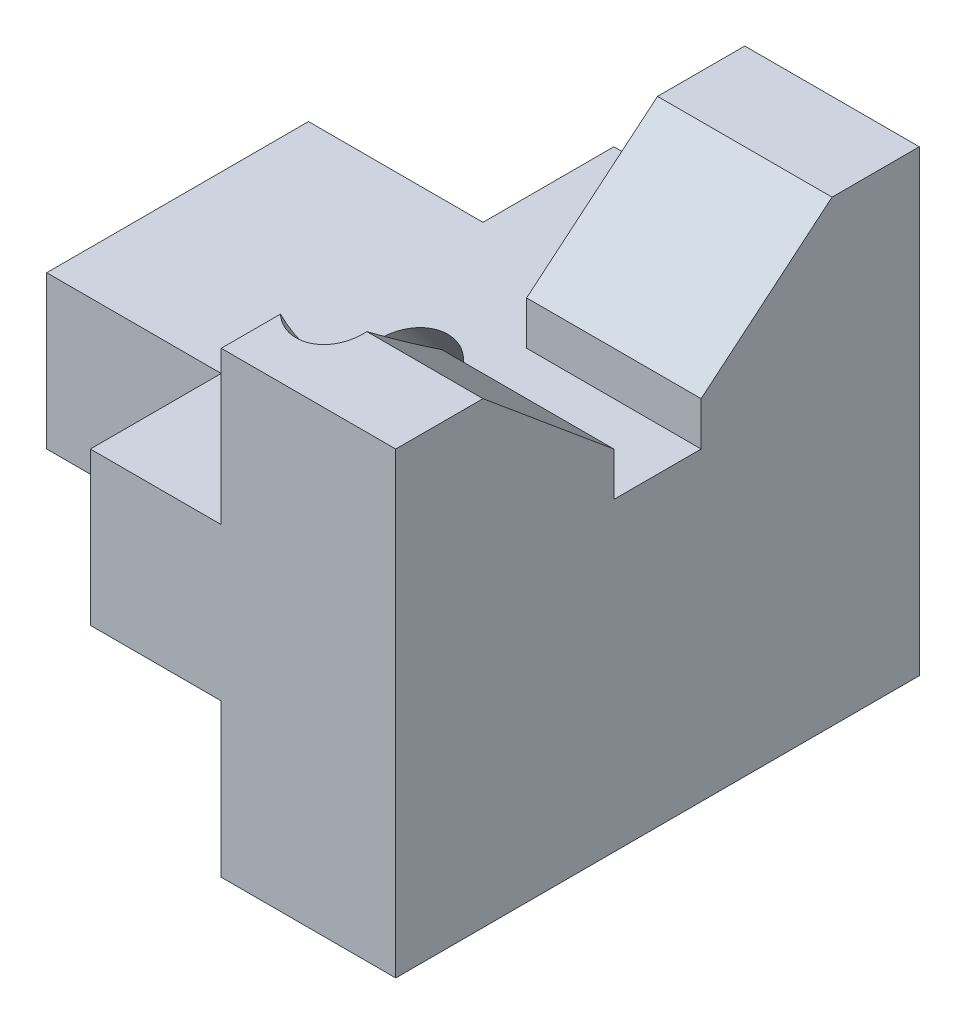
from build123d import *

# Parameters (mm, degrees)
BOSS_EXTRUDE1_DEPTH = 25.4
BOSS_EXTRUDE2_DEPTH = 22.225
SKETCH5_R           = 5.373343104
CUT_EXTRUDE1_DEPTH  = 60.6425
SKETCH6_W           = 0.284935897
SKETCH6_H           = 2.320192307
BOSS_EXTRUDE3_DEPTH = 2.54


with BuildPart() as part:
    # Sketch2 → Boss-Extrude1 (new body)
    with BuildSketch(Plane(origin=(0, 0, 0), x_dir=(0, 0, -1), z_dir=(1, 0, 0))):
        Polygon((38.1, 0), (38.1, 66.675), (25.4, 66.675), (6.35, 50.8), (6.35, 44.45), (-6.35, 44.45), (-6.35, 50.8), (-25.4, 66.675), (-38.1, 66.675), (-38.1, 0), align=None)
    extrude(amount=BOSS_EXTRUDE1_DEPTH)

    # Sketch3 → Boss-Extrude2 (add)
    with BuildSketch(Plane(origin=(0, 44.45, 0), x_dir=(1, 0, 0), z_dir=(0, 1, 0))):
        Polygon((0, 6.35), (0, 38.1), (-19.05, 38.1), (-19.05, 19.05), (-44.45, 19.05), (-44.45, -19.05), (-19.05, -19.05), (-19.05, -38.1), (0, -38.1), (0, -6.35), align=None)
    extrude(amount=-BOSS_EXTRUDE2_DEPTH)

    # Sketch5 → Cut-Extrude1 (cut, symmetric)
    with BuildSketch(Plane(origin=(8.980702108, 22.580051014, 19.757544637), x_dir=(0.9580053224689881, -0.21580168165029512, -0.1888264714440082), z_dir=(0.28675041782199756, 0.7209724790953078, 0.6308509192083942))):
        with Locations(Location((-16.337016409, 25.690827368, 0), (0, 0, 108.144733804))):
            Circle(SKETCH5_R)
    extrude(amount=CUT_EXTRUDE1_DEPTH, both=True, mode=Mode.SUBTRACT)

    # Sketch6 → Boss-Extrude3 (add)
    # profile 1 of 17: a face of its own
    with BuildSketch(Plane.XY.offset(38.1)):
        with BuildLine():
            Line((-13.170934397, 34.234214461), (-12.902534958, 34.395126921))
            add(Edge.make_bspline(
                [(-12.902534958, 34.395126921), (-12.877571986, 34.353339944), (-12.829743894, 34.273277707), (-12.749959447, 34.165093627), (-12.667288878, 34.073143671), (-12.581119982, 33.997962748), (-12.491978729, 33.938772687), (-12.399283195, 33.896860662), (-12.303345752, 33.870720456), (-12.238055214, 33.867545377), (-12.205459638, 33.865960255)],
                knots=[0, 0, 0, 0, 1.272034388, 2.437168799, 3.508375237, 4.49857839, 5.41946034, 6.295179144, 7.148887113, 8, 8, 8, 8], degree=3))
            add(Edge.make_bspline(
                [(-12.205459638, 33.865960255), (-12.177622271, 33.866735565), (-12.122434627, 33.868272619), (-12.041188878, 33.883041632), (-11.962283958, 33.905731206), (-11.887346122, 33.938225908), (-11.817409386, 33.977540106), (-11.756080455, 34.025025567), (-11.703061481, 34.078189768), (-11.659691784, 34.137501176), (-11.626417752, 34.201288875), (-11.600843519, 34.266762774), (-11.586651202, 34.334951404), (-11.58451329, 34.380862324), (-11.583434397, 34.404031168)],
                knots=[0, 0, 0, 0, 1.095163259, 2.171163733, 3.241058638, 4.321873601, 5.38011039, 6.391990106, 7.366004449, 8.327778327, 9.272591725, 10.192022065, 11.087607919, 12, 12, 12, 12], degree=3))
            add(Edge.make_bspline(
                [(-11.583434397, 34.404031168), (-11.584771808, 34.430466082), (-11.587490568, 34.484204398), (-11.610469839, 34.563488369), (-11.646618799, 34.641949486), (-11.679967768, 34.690482777), (-11.697281553, 34.715679806)],
                knots=[0, 0, 0, 0, 0.938893495, 1.908633276, 2.914225137, 4, 4, 4, 4], degree=3))
            add(Edge.make_bspline(
                [(-11.697281553, 34.715679806), (-11.711497039, 34.733865139), (-11.741340673, 34.77204297), (-11.792646416, 34.828871148), (-11.852849963, 34.887489286), (-11.919891045, 34.950135716), (-11.996211775, 35.013896788), (-12.079421735, 35.081813012), (-12.171645378, 35.151301585), (-12.236324207, 35.197903841), (-12.269697418, 35.221949838)],
                knots=[0, 0, 0, 0, 0.722233717, 1.516239348, 2.393582979, 3.351407094, 4.387010283, 5.505090956, 6.712668013, 8, 8, 8, 8], degree=3))
            add(Edge.make_bspline(
                [(-12.269697418, 35.221949838), (-12.303102043, 35.245742914), (-12.366969143, 35.291233463), (-12.456285143, 35.358746921), (-12.536154048, 35.420472431), (-12.60622087, 35.476991071), (-12.66645479, 35.528310505), (-12.717330456, 35.573937921), (-12.757551861, 35.615107294), (-12.779917995, 35.641814797), (-12.789959838, 35.653805808)],
                knots=[0, 0, 0, 0, 1.452282411, 2.77665338, 3.964542531, 5.026858415, 5.96415736, 6.766646006, 7.446254459, 8, 8, 8, 8], degree=3))
            add(Edge.make_bspline(
                [(-12.789959838, 35.653805808), (-12.803995647, 35.672493891), (-12.831598949, 35.709246515), (-12.868035254, 35.766691208), (-12.899004352, 35.82549517), (-12.92328161, 35.885816418), (-12.94372518, 35.946808104), (-12.957475588, 36.00926602), (-12.966085641, 36.072909909), (-12.966967372, 36.115739299), (-12.967408756, 36.137179205)],
                knots=[0, 0, 0, 0, 1.068054152, 2.10047183, 3.106115577, 4.101338837, 5.06977816, 6.043150881, 7.020423561, 8, 8, 8, 8], degree=3))
            add(Edge.make_bspline(
                [(-12.967408756, 36.137179205), (-12.966224745, 36.170770501), (-12.963882031, 36.237235101), (-12.944069561, 36.334327355), (-12.912797722, 36.427025033), (-12.86898736, 36.514410407), (-12.812511047, 36.594208118), (-12.747155056, 36.667336067), (-12.669311779, 36.728811853), (-12.583901899, 36.782525648), (-12.490415047, 36.824568023), (-12.392451871, 36.856282627), (-12.28985667, 36.874252454), (-12.220366683, 36.876831247), (-12.185107074, 36.878139742)],
                knots=[0, 0, 0, 0, 1.005424448, 1.989358655, 2.955360095, 3.929531133, 4.905563448, 5.876582895, 6.856512386, 7.866279853, 8.892233794, 9.918561126, 10.94386622, 12, 12, 12, 12], degree=3))
            add(Edge.make_bspline(
                [(-12.185107074, 36.878139742), (-12.147692783, 36.876849284), (-12.073287699, 36.874282976), (-11.963841625, 36.851969501), (-11.858467261, 36.815048178), (-11.773700871, 36.773148467), (-11.707359009, 36.731300682), (-11.656765173, 36.693182699), (-11.605495771, 36.649299565), (-11.55313725, 36.599534391), (-11.500576794, 36.543430553), (-11.447034091, 36.481372285), (-11.392383933, 36.413738838), (-11.357226831, 36.365456612), (-11.339203628, 36.340704846)],
                knots=[0, 0, 0, 0, 1.286793592, 2.559021753, 3.825965368, 5.121522368, 5.803751409, 6.523245864, 7.299691795, 8.125521123, 9.008227632, 9.944561021, 10.946284179, 12, 12, 12, 12], degree=3))
            Line((-11.339203628, 36.340704846), (-11.596790768, 36.145447434))
            add(Edge.make_bspline(
                [(-11.596790768, 36.145447434), (-11.612344578, 36.165485032), (-11.64229758, 36.20407276), (-11.687772185, 36.258112454), (-11.730633459, 36.307475974), (-11.772861322, 36.350352198), (-11.812225544, 36.389089133), (-11.850431718, 36.422254055), (-11.886930023, 36.450171917), (-11.932937506, 36.479965718), (-11.990738579, 36.509499117), (-12.06329598, 36.534490067), (-12.139120672, 36.549507873), (-12.190763981, 36.551493507), (-12.216907955, 36.552498716)],
                knots=[0, 0, 0, 0, 1.181633172, 2.275549214, 3.290209073, 4.226197932, 5.078386478, 5.862611352, 6.581680152, 7.217281963, 8.414376989, 9.595101626, 10.782541182, 12, 12, 12, 12], degree=3))
            add(Edge.make_bspline(
                [(-12.216907955, 36.552498716), (-12.249707086, 36.551399531), (-12.312957121, 36.549279857), (-12.402755406, 36.526129584), (-12.483576324, 36.489678897), (-12.553020437, 36.438593167), (-12.61083898, 36.378067695), (-12.652663218, 36.308418305), (-12.677836581, 36.231508554), (-12.680908421, 36.177858623), (-12.682472859, 36.150535575)],
                knots=[0, 0, 0, 0, 1.14458467, 2.207223713, 3.21896685, 4.227309161, 5.202851033, 6.127160689, 7.046193047, 8, 8, 8, 8], degree=3))
            add(Edge.make_bspline(
                [(-12.682472859, 36.150535575), (-12.682116237, 36.133525305), (-12.68140241, 36.099476951), (-12.6714467, 36.049174589), (-12.658656595, 35.998999303), (-12.638388636, 35.949176674), (-12.610407539, 35.898835363), (-12.573663558, 35.847108501), (-12.527387197, 35.793540165), (-12.491938764, 35.75869919), (-12.473223059, 35.740304205)],
                knots=[0, 0, 0, 0, 0.858281714, 1.717966888, 2.583508476, 3.4729293, 4.427298488, 5.488583878, 6.674047936, 8, 8, 8, 8], degree=3))
            add(Edge.make_bspline(
                [(-12.473223059, 35.740304205), (-12.4662731, 35.734102046), (-12.449761588, 35.719367136), (-12.419575569, 35.695244138), (-12.379713174, 35.665487337), (-12.33121532, 35.628668843), (-12.273187785, 35.585959231), (-12.205624187, 35.537904597), (-12.129277654, 35.482944931), (-12.075101344, 35.444520591), (-12.046455231, 35.424203444)],
                knots=[0, 0, 0, 0, 0.420754252, 0.999615792, 1.744751191, 2.668019286, 3.750313428, 4.999500688, 6.413464383, 8, 8, 8, 8], degree=3))
            add(Edge.make_bspline(
                [(-12.046455231, 35.424203444), (-12.011996581, 35.399128782), (-11.945272181, 35.350575175), (-11.850332805, 35.277626665), (-11.764250565, 35.206281903), (-11.68672323, 35.136996503), (-11.616984892, 35.070296018), (-11.555809245, 35.00537799), (-11.502572949, 34.942707507), (-11.445260373, 34.862359527), (-11.386697208, 34.763679544), (-11.33640384, 34.642777141), (-11.304691625, 34.521404765), (-11.300544608, 34.439828278), (-11.2984985, 34.399579045)],
                knots=[0, 0, 0, 0, 1.163667725, 2.253281268, 3.268753668, 4.215851969, 5.092017293, 5.902905408, 6.650798638, 7.335211899, 8.59617414, 9.77448103, 10.901945474, 12, 12, 12, 12], degree=3))
            add(Edge.make_bspline(
                [(-11.2984985, 34.399579045), (-11.299094618, 34.371114385), (-11.300275278, 34.31473783), (-11.313846964, 34.231956439), (-11.333731232, 34.151555578), (-11.363700723, 34.074529069), (-11.400279588, 33.999467749), (-11.446694684, 33.928340582), (-11.500495227, 33.859573349), (-11.56221157, 33.794999753), (-11.629744639, 33.735721418), (-11.701121991, 33.682990055), (-11.776460452, 33.639022362), (-11.855351325, 33.603144098), (-11.937812731, 33.575082979), (-12.023816935, 33.554751305), (-12.113505706, 33.54227291), (-12.174466143, 33.540977726), (-12.205459638, 33.540319229)],
                knots=[0, 0, 0, 0, 0.983748083, 1.948392443, 2.894712957, 3.844097841, 4.80183111, 5.778335162, 6.776009319, 7.81870978, 8.863265674, 9.881300176, 10.883814829, 11.87499822, 12.874611388, 13.892143829, 14.928324115, 16, 16, 16, 16], degree=3))
            add(Edge.make_bspline(
                [(-12.205459638, 33.540319229), (-12.22944027, 33.540782944), (-12.277099524, 33.541704533), (-12.347593126, 33.549851838), (-12.41666261, 33.561378996), (-12.48344128, 33.579679759), (-12.548789504, 33.601883874), (-12.612423066, 33.629223647), (-12.674372808, 33.661987109), (-12.734985901, 33.699447595), (-12.794108188, 33.743042835), (-12.851185134, 33.793818793), (-12.908089466, 33.850375072), (-12.963141605, 33.914247512), (-13.0174551, 33.984404201), (-13.069959086, 34.061501532), (-13.121740358, 34.14511956), (-13.154230104, 34.203961459), (-13.170934397, 34.234214461)],
                knots=[0, 0, 0, 0, 0.915332311, 1.819136955, 2.706846663, 3.586547465, 4.459518054, 5.340707479, 6.227863349, 7.133153174, 8.059268498, 9.028702269, 10.047606654, 11.120612155, 12.245963614, 13.433783089, 14.680604001, 16, 16, 16, 16], degree=3))
        make_face()
    # profile 2 of 17: a face of its own
    with BuildSketch(Plane.XY.offset(38.1)):
        Polygon((-10.443690808, 36.878139742), (-10.15875491, 36.878139742), (-10.15875491, 35.941921793), (-9.751703628, 35.941921793), (-9.751703628, 35.656985896), (-10.15875491, 35.656985896), (-10.15875491, 33.621729486), (-10.443690808, 33.621729486), (-10.443690808, 35.656985896), (-10.85074209, 35.656985896), (-10.85074209, 35.941921793), (-10.443690808, 35.941921793), align=None)
    # profile 3 of 17: a face of its own
    with BuildSketch(Plane.XY.offset(38.1)):
        with BuildLine():
            Line((-6.902344654, 35.941921793), (-6.902344654, 33.621729486))
            Line((-6.902344654, 33.621729486), (-7.187280551, 33.621729486))
            Line((-7.187280551, 33.621729486), (-7.187280551, 34.023056609))
            add(Edge.make_bspline(
                [(-7.187280551, 34.023056609), (-7.219410454, 33.986734977), (-7.282112364, 33.915852856), (-7.386833949, 33.823249743), (-7.497839368, 33.746706551), (-7.614589852, 33.684884842), (-7.736979973, 33.638446334), (-7.864738423, 33.605438889), (-7.997917319, 33.584217339), (-8.088860526, 33.582098233), (-8.134946817, 33.581024357)],
                knots=[0, 0, 0, 0, 1.074387032, 2.096679803, 3.090159297, 4.057316773, 5.018401886, 5.985159533, 6.978961417, 8, 8, 8, 8], degree=3))
            add(Edge.make_bspline(
                [(-8.134946817, 33.581024357), (-8.175920604, 33.582136852), (-8.256722726, 33.584330741), (-8.375584817, 33.601350831), (-8.4899685, 33.628683609), (-8.599981863, 33.666693702), (-8.704913023, 33.717113447), (-8.805660397, 33.777475865), (-8.901702053, 33.849358618), (-8.991574092, 33.931534901), (-9.074334549, 34.020793211), (-9.146961561, 34.115993814), (-9.207516141, 34.216725047), (-9.258152928, 34.321711551), (-9.297156755, 34.431761513), (-9.324347123, 34.546494373), (-9.341347385, 34.665774472), (-9.343540368, 34.746999611), (-9.344652346, 34.788185816)],
                knots=[0, 0, 0, 0, 1.033919861, 2.038935746, 3.024066025, 3.998881131, 4.97069526, 5.957263378, 6.95902576, 7.993208707, 9.027059324, 10.027763471, 11.009749337, 11.988697705, 12.965288445, 13.950418724, 14.960734635, 16, 16, 16, 16], degree=3))
            add(Edge.make_bspline(
                [(-9.344652346, 34.788185816), (-9.343515722, 34.828520747), (-9.341268678, 34.90826073), (-9.324528971, 35.025534977), (-9.296379413, 35.138490828), (-9.256875294, 35.246764626), (-9.206218664, 35.350487386), (-9.144598185, 35.449732466), (-9.072009407, 35.544773277), (-8.988323295, 35.633375032), (-8.897668182, 35.715218018), (-8.800686691, 35.786346224), (-8.699791286, 35.847775079), (-8.593416983, 35.896446447), (-8.483138252, 35.935824706), (-8.367973341, 35.963068899), (-8.248401409, 35.979122897), (-8.167220748, 35.98144769), (-8.12604257, 35.982626921)],
                knots=[0, 0, 0, 0, 1.020392517, 2.01726096, 2.990465484, 3.961182959, 4.928053699, 5.906110375, 6.912531644, 7.948652711, 8.985773172, 9.998621852, 10.987621588, 11.969261332, 12.953316658, 13.946091881, 14.958173133, 16, 16, 16, 16], degree=3))
            add(Edge.make_bspline(
                [(-8.12604257, 35.982626921), (-8.078689841, 35.981322675), (-7.985833374, 35.97876511), (-7.85000868, 35.957481065), (-7.721516903, 35.921523313), (-7.59936617, 35.872612439), (-7.483995119, 35.807616807), (-7.376495983, 35.725629271), (-7.275743723, 35.627166908), (-7.217341601, 35.551538005), (-7.187280551, 35.512609894)],
                knots=[0, 0, 0, 0, 1.038897134, 2.037228247, 3.008116434, 3.962042015, 4.918381754, 5.904844433, 6.921570401, 8, 8, 8, 8], degree=3))
            Line((-7.187280551, 35.512609894), (-7.187280551, 35.941921793))
            Line((-7.187280551, 35.941921793), (-6.902344654, 35.941921793))
        make_face()
        with BuildLine():
            add(Edge.make_bspline(
                [(-8.122226465, 35.697691024), (-8.163877328, 35.696209081), (-8.246089508, 35.693283962), (-8.366779424, 35.670448005), (-8.482270879, 35.632452695), (-8.591986246, 35.580489827), (-8.694192414, 35.515149473), (-8.785535958, 35.436117933), (-8.86676398, 35.345551499), (-8.935079334, 35.24385887), (-8.990769285, 35.134840173), (-9.02992795, 35.020880861), (-9.055753624, 34.904036346), (-9.058392068, 34.82478591), (-9.059716449, 34.785005728)],
                knots=[0, 0, 0, 0, 1.031046209, 2.035121221, 3.029706178, 4.034933723, 5.034054252, 6.02443088, 7.017295772, 8.038157696, 9.050218397, 10.03989886, 11.016116709, 12, 12, 12, 12], degree=3))
            add(Edge.make_bspline(
                [(-9.059716449, 34.785005728), (-9.058024724, 34.745463273), (-9.054647906, 34.666533357), (-9.030381204, 34.549529549), (-8.989668748, 34.435543382), (-8.934113448, 34.325542338), (-8.864547724, 34.223412475), (-8.783913018, 34.13111965), (-8.691429548, 34.051754095), (-8.588988167, 33.985317153), (-8.479579508, 33.931648295), (-8.364523013, 33.894305179), (-8.245981541, 33.870195335), (-8.165379781, 33.867379131), (-8.124770535, 33.865960255)],
                knots=[0, 0, 0, 0, 0.979072187, 1.954306742, 2.945804271, 3.96968567, 4.997920485, 5.998718438, 6.996577872, 8.005894225, 9.015743152, 10.005417472, 10.995077863, 12, 12, 12, 12], degree=3))
            add(Edge.make_bspline(
                [(-8.124770535, 33.865960255), (-8.083544065, 33.867466079), (-8.001548704, 33.870461015), (-7.880500734, 33.893394734), (-7.763030303, 33.931285001), (-7.650737603, 33.98380778), (-7.546129398, 34.048901953), (-7.452242038, 34.125108386), (-7.372852552, 34.213739131), (-7.305549256, 34.311144914), (-7.252775843, 34.41792651), (-7.214334703, 34.531622526), (-7.191607232, 34.652236919), (-7.18874272, 34.734663482), (-7.187280551, 34.776737498)],
                knots=[0, 0, 0, 0, 1.01762866, 2.023962475, 3.030623092, 4.058876274, 5.077231937, 6.066672613, 7.034107872, 8.005628644, 8.981990164, 9.965428785, 10.961468474, 12, 12, 12, 12], degree=3))
            add(Edge.make_bspline(
                [(-7.187280551, 34.776737498), (-7.188151097, 34.808793959), (-7.189864606, 34.871891218), (-7.202955194, 34.964535466), (-7.223778591, 35.053193917), (-7.253121188, 35.137959785), (-7.291666853, 35.218364406), (-7.338155898, 35.294985103), (-7.393405842, 35.367423373), (-7.456527288, 35.434681731), (-7.525620007, 35.496028593), (-7.598730769, 35.550787583), (-7.676725775, 35.595771684), (-7.758293373, 35.63300198), (-7.843575083, 35.662628494), (-7.93326486, 35.682393045), (-8.02640937, 35.695964194), (-8.089951148, 35.697109353), (-8.122226465, 35.697691024)],
                knots=[0, 0, 0, 0, 1.050140795, 2.067009409, 3.05949893, 4.030605086, 5.00011959, 5.97591094, 6.962425594, 7.979863591, 8.993523472, 9.986985069, 10.967611495, 11.937549037, 12.921786183, 13.919465291, 14.943216303, 16, 16, 16, 16], degree=3))
        make_face(mode=Mode.SUBTRACT)
    # profile 4 of 17: a face of its own
    with BuildSketch(Plane.XY.offset(38.1)):
        with BuildLine():
            Line((-3.971575423, 35.438831849), (-4.210082034, 35.290639742))
            add(Edge.make_bspline(
                [(-4.210082034, 35.290639742), (-4.23623484, 35.323141213), (-4.287712199, 35.387114842), (-4.377101364, 35.469673853), (-4.472361718, 35.540582527), (-4.57512109, 35.598370929), (-4.685235351, 35.643021816), (-4.802270252, 35.674617789), (-4.926209103, 35.694306637), (-5.011176819, 35.696544411), (-5.054713444, 35.697691024)],
                knots=[0, 0, 0, 0, 1.026593902, 2.0206758, 2.988051866, 3.946915611, 4.916868779, 5.907761954, 6.927957743, 8, 8, 8, 8], degree=3))
            add(Edge.make_bspline(
                [(-5.054713444, 35.697691024), (-5.089510498, 35.696732317), (-5.158042349, 35.69484417), (-5.258650074, 35.683041794), (-5.35448278, 35.661595115), (-5.446141137, 35.633336747), (-5.532973231, 35.59546327), (-5.615206564, 35.549371562), (-5.693570545, 35.49580474), (-5.765794303, 35.433746603), (-5.831860616, 35.366256383), (-5.889100345, 35.293908388), (-5.938935992, 35.218869629), (-5.978039252, 35.139266263), (-6.010038871, 35.056919415), (-6.031090682, 34.970274703), (-6.04511937, 34.880442153), (-6.046724404, 34.819193373), (-6.047536961, 34.788185816)],
                knots=[0, 0, 0, 0, 1.112346261, 2.190735716, 3.231507886, 4.247384806, 5.251966152, 6.253067467, 7.256802811, 8.280671706, 9.291813951, 10.270744147, 11.225547591, 12.165006084, 13.100104208, 14.043489273, 15.009504848, 16, 16, 16, 16], degree=3))
            add(Edge.make_bspline(
                [(-6.047536961, 34.788185816), (-6.045922926, 34.747573746), (-6.042716601, 34.666896818), (-6.01758742, 34.547808826), (-5.976453565, 34.432670907), (-5.920158229, 34.322300525), (-5.848968257, 34.220161541), (-5.765354575, 34.128555122), (-5.669270835, 34.049256296), (-5.561563649, 33.983513363), (-5.444761982, 33.930661979), (-5.32012953, 33.893008899), (-5.188684729, 33.870282818), (-5.098690037, 33.867419927), (-5.052805391, 33.865960255)],
                knots=[0, 0, 0, 0, 0.966302908, 1.919585723, 2.883856336, 3.870342332, 4.860282998, 5.839159637, 6.814385684, 7.815993281, 8.834850808, 9.858348828, 10.908058873, 12, 12, 12, 12], degree=3))
            add(Edge.make_bspline(
                [(-5.052805391, 33.865960255), (-5.010754617, 33.867139084), (-4.928113686, 33.869455797), (-4.807311935, 33.888985643), (-4.692304444, 33.920956653), (-4.583095302, 33.965540593), (-4.479884066, 34.023169125), (-4.3833376, 34.094252087), (-4.291534799, 34.176744575), (-4.237562541, 34.24053302), (-4.210082034, 34.273011537)],
                knots=[0, 0, 0, 0, 1.039848629, 2.043578496, 3.018386758, 3.987534228, 4.954977003, 5.934852016, 6.948509513, 8, 8, 8, 8], degree=3))
            Line((-4.210082034, 34.273011537), (-3.971575423, 34.1165512))
            add(Edge.make_bspline(
                [(-3.971575423, 34.1165512), (-3.985715696, 34.095786041), (-4.013949308, 34.054324644), (-4.061145797, 33.995864624), (-4.112054501, 33.941144241), (-4.16647681, 33.890236844), (-4.223702112, 33.841924212), (-4.285685287, 33.798515998), (-4.350427721, 33.757572266), (-4.418689457, 33.720730589), (-4.489764733, 33.687614141), (-4.563553537, 33.659137864), (-4.639735225, 33.634672125), (-4.718399366, 33.615225389), (-4.799701045, 33.599703414), (-4.883429999, 33.589403985), (-4.969557391, 33.581715694), (-5.0277707, 33.581256801), (-5.057257514, 33.581024357)],
                knots=[0, 0, 0, 0, 0.954134338, 1.905101784, 2.851144739, 3.791306361, 4.734911809, 5.6936923, 6.663572882, 7.643865596, 8.638447847, 9.640600242, 10.646758161, 11.676244097, 12.717260333, 13.78922464, 14.880174919, 16, 16, 16, 16], degree=3))
            add(Edge.make_bspline(
                [(-5.057257514, 33.581024357), (-5.102261673, 33.581832875), (-5.190470151, 33.583417577), (-5.319576997, 33.600842408), (-5.442960824, 33.627111103), (-5.560579477, 33.664815347), (-5.672451268, 33.713351822), (-5.778471883, 33.77263988), (-5.878290271, 33.843171861), (-5.970919338, 33.923692373), (-6.055992507, 34.010996383), (-6.129041265, 34.105203094), (-6.192400904, 34.202848902), (-6.243280318, 34.306090401), (-6.283781458, 34.413555417), (-6.311453699, 34.526104849), (-6.32935139, 34.642810823), (-6.331422741, 34.72239708), (-6.332472859, 34.762745111)],
                knots=[0, 0, 0, 0, 1.1129367, 2.181364009, 3.217532258, 4.231199276, 5.232079859, 6.230262199, 7.231623845, 8.250719726, 9.263571943, 10.242672461, 11.195837495, 12.138959767, 13.085126421, 14.0317438, 15.002148558, 16, 16, 16, 16], degree=3))
            add(Edge.make_bspline(
                [(-6.332472859, 34.762745111), (-6.332072794, 34.790121262), (-6.331277, 34.844576945), (-6.322149394, 34.925398899), (-6.310357922, 35.005144508), (-6.290377432, 35.082802939), (-6.267299145, 35.159552023), (-6.237839198, 35.234466694), (-6.203281233, 35.307895076), (-6.164045537, 35.379648016), (-6.11987789, 35.448545098), (-6.070999914, 35.513635923), (-6.019252552, 35.575702424), (-5.962214936, 35.632601836), (-5.902307536, 35.686609666), (-5.837835464, 35.736283108), (-5.769168513, 35.78176815), (-5.697337927, 35.823905856), (-5.62238551, 35.861424772), (-5.544764317, 35.89374921), (-5.464942069, 35.921374046), (-5.382791081, 35.94324428), (-5.298856624, 35.961584371), (-5.212477267, 35.973121275), (-5.123983465, 35.981273108), (-5.064061216, 35.982171898), (-5.033724862, 35.982626921)],
                knots=[0, 0, 0, 0, 0.990994727, 1.971252077, 2.943264845, 3.907940874, 4.872158414, 5.844625996, 6.82015047, 7.809835459, 8.804511986, 9.781214284, 10.756496977, 11.728388426, 12.696359165, 13.676225489, 14.672885716, 15.677705647, 16.690706858, 17.706033469, 18.721040654, 19.747369689, 20.783475414, 21.830280724, 22.901553713, 24, 24, 24, 24], degree=3))
            add(Edge.make_bspline(
                [(-5.033724862, 35.982626921), (-4.995733621, 35.981790635), (-4.919941038, 35.980122241), (-4.807509111, 35.966080892), (-4.696733185, 35.944911429), (-4.589556884, 35.913548933), (-4.487279689, 35.875572617), (-4.391543959, 35.832925369), (-4.304603293, 35.783400264), (-4.224840409, 35.729225589), (-4.152106132, 35.668119625), (-4.085653843, 35.599351885), (-4.024120847, 35.523280264), (-3.989235115, 35.467213637), (-3.971575423, 35.438831849)],
                knots=[0, 0, 0, 0, 1.095225653, 2.184976855, 3.262915854, 4.344593502, 5.400796181, 6.407717688, 7.363229445, 8.282371371, 9.184954523, 10.097238608, 11.036792983, 12, 12, 12, 12], degree=3))
        make_face()
    # profile 5 of 17: a face of its own
    with BuildSketch(Plane.XY.offset(38.1)):
        with BuildLine():
            add(Edge.make_bspline(
                [(-3.301212843, 36.91884487), (-3.283531435, 36.918024675), (-3.248907842, 36.916418575), (-3.198839664, 36.902664949), (-3.153249374, 36.879351663), (-3.112811002, 36.848073667), (-3.078111077, 36.811289529), (-3.053817147, 36.768417079), (-3.038203044, 36.722099599), (-3.036317498, 36.689791626), (-3.035357474, 36.673342066)],
                knots=[0, 0, 0, 0, 1.055194115, 2.066272739, 3.074728998, 4.095836921, 5.109056067, 6.073838105, 7.019297344, 8, 8, 8, 8], degree=3))
            add(Edge.make_bspline(
                [(-3.035357474, 36.673342066), (-3.036339148, 36.657319516), (-3.0382798, 36.625644832), (-3.053805086, 36.580130325), (-3.078318116, 36.537853582), (-3.112788752, 36.501140866), (-3.15325527, 36.469880161), (-3.198838098, 36.446562291), (-3.248908254, 36.43280988), (-3.283531574, 36.431203613), (-3.301212843, 36.430383332)],
                knots=[0, 0, 0, 0, 0.96129708, 1.900370562, 2.859976407, 3.87933698, 4.906634145, 5.921202961, 6.938410037, 8, 8, 8, 8], degree=3))
            add(Edge.make_bspline(
                [(-3.301212843, 36.430383332), (-3.318691921, 36.431172292), (-3.352712663, 36.432707901), (-3.402031156, 36.446832131), (-3.447232714, 36.46988814), (-3.487749953, 36.50093618), (-3.521523057, 36.538079051), (-3.546105109, 36.580104524), (-3.561594539, 36.6256514), (-3.563540023, 36.657321723), (-3.564524141, 36.673342066)],
                knots=[0, 0, 0, 0, 1.054934014, 2.053291228, 3.073705704, 4.106921865, 5.123545215, 6.088680038, 7.033164197, 8, 8, 8, 8], degree=3))
            add(Edge.make_bspline(
                [(-3.564524141, 36.673342066), (-3.563561584, 36.689789336), (-3.561671061, 36.722092814), (-3.546093498, 36.768443308), (-3.521727816, 36.811062242), (-3.48772759, 36.84827823), (-3.447238665, 36.879343732), (-3.402029618, 36.902395122), (-3.352713069, 36.916520552), (-3.318692059, 36.918055995), (-3.301212843, 36.91884487)],
                knots=[0, 0, 0, 0, 0.98631895, 1.937192651, 2.907499808, 3.917963147, 4.944918757, 5.95915025, 6.951458133, 8, 8, 8, 8], degree=3))
        make_face()
    # profile 6 of 17: a face of its own
    with BuildSketch(Plane.XY.offset(38.1)):
        with Locations((-3.299940808, 34.781825639)):
            Rectangle(SKETCH6_W, SKETCH6_H)
    # profile 7 of 17: a face of its own
    with BuildSketch(Plane.XY.offset(38.1)):
        with BuildLine():
            Line((-0.561248901, 34.354421793), (-0.308113885, 34.221494109))
            add(Edge.make_bspline(
                [(-0.308113885, 34.221494109), (-0.328285653, 34.185713373), (-0.367531927, 34.116098229), (-0.435024034, 34.02045647), (-0.505773985, 33.934416042), (-0.582975442, 33.86027557), (-0.664318651, 33.795640385), (-0.750254702, 33.739091073), (-0.841230986, 33.690904987), (-0.937251808, 33.650308051), (-1.039123544, 33.619093724), (-1.147093062, 33.597046323), (-1.261367204, 33.583418073), (-1.339695525, 33.581834981), (-1.379803588, 33.581024357)],
                knots=[0, 0, 0, 0, 1.120438281, 2.179929193, 3.190490725, 4.156257408, 5.095198341, 6.022838206, 6.959905092, 7.901321166, 8.864066838, 9.862729781, 10.905609505, 12, 12, 12, 12], degree=3))
            add(Edge.make_bspline(
                [(-1.379803588, 33.581024357), (-1.424382382, 33.582065009), (-1.511342694, 33.58409502), (-1.637925179, 33.601596041), (-1.75710508, 33.630145966), (-1.868875697, 33.670028993), (-1.972963312, 33.72212378), (-2.069574801, 33.785587024), (-2.159218228, 33.860092712), (-2.239068761, 33.9462862), (-2.310954283, 34.038526262), (-2.374386991, 34.134643386), (-2.427416232, 34.234395739), (-2.470553243, 34.337148286), (-2.505391942, 34.442253389), (-2.529673166, 34.550667364), (-2.543670152, 34.662096786), (-2.545815042, 34.737477941), (-2.546895936, 34.775465463)],
                knots=[0, 0, 0, 0, 1.145258523, 2.234067595, 3.276747158, 4.290159414, 5.277019952, 6.260822364, 7.254936242, 8.264827045, 9.274100331, 10.257902744, 11.220704747, 12.172965371, 13.118907548, 14.062713208, 15.023725156, 16, 16, 16, 16], degree=3))
            add(Edge.make_bspline(
                [(-2.546895936, 34.775465463), (-2.545935143, 34.811111488), (-2.54403098, 34.881757201), (-2.532028765, 34.986319517), (-2.510757814, 35.087945327), (-2.481569291, 35.186719077), (-2.443876375, 35.282475384), (-2.39776429, 35.375272527), (-2.343161205, 35.465011761), (-2.301003851, 35.521620318), (-2.279768532, 35.550134934)],
                knots=[0, 0, 0, 0, 1.024358464, 2.0301432, 3.019427413, 4.004406732, 4.986367066, 5.972626655, 6.978780325, 8, 8, 8, 8], degree=3))
            add(Edge.make_bspline(
                [(-2.279768532, 35.550134934), (-2.251005134, 35.584487409), (-2.19438949, 35.65210416), (-2.098634796, 35.740948213), (-1.994948189, 35.815373637), (-1.884629071, 35.877065825), (-1.76639527, 35.923941205), (-1.641836127, 35.958873083), (-1.509533345, 35.978447422), (-1.419086466, 35.981212242), (-1.372807394, 35.982626921)],
                knots=[0, 0, 0, 0, 1.030682036, 2.02871468, 2.997146059, 3.962720338, 4.930598197, 5.918074684, 6.934738563, 8, 8, 8, 8], degree=3))
            add(Edge.make_bspline(
                [(-1.372807394, 35.982626921), (-1.325229924, 35.981398606), (-1.231893772, 35.97898893), (-1.095793205, 35.956649328), (-0.967014555, 35.921223082), (-0.845609355, 35.871190715), (-0.731565295, 35.806638835), (-0.625623665, 35.726681594), (-0.52597265, 35.633773757), (-0.467998439, 35.562324274), (-0.438497498, 35.525966264)],
                knots=[0, 0, 0, 0, 1.056321875, 2.072262726, 3.055038591, 4.01806755, 4.982017516, 5.957941055, 6.960871419, 8, 8, 8, 8], degree=3))
            add(Edge.make_bspline(
                [(-0.438497498, 35.525966264), (-0.418425204, 35.498567301), (-0.378414223, 35.443951751), (-0.328297211, 35.354896487), (-0.284793003, 35.261723305), (-0.250019531, 35.162926107), (-0.221862269, 35.059675488), (-0.201490727, 34.951233322), (-0.189544001, 34.837631902), (-0.187195683, 34.760228527), (-0.1859985, 34.720767947)],
                knots=[0, 0, 0, 0, 0.94817472, 1.890038105, 2.849395472, 3.817997239, 4.812318967, 5.836947057, 6.897266129, 8, 8, 8, 8], degree=3))
            Line((-0.1859985, 34.720767947), (-2.261960038, 34.720767947))
            add(Edge.make_bspline(
                [(-2.261960038, 34.720767947), (-2.260563395, 34.690196812), (-2.257816953, 34.630079907), (-2.245012502, 34.542113554), (-2.224829686, 34.458317736), (-2.196464179, 34.379320977), (-2.162113541, 34.304091504), (-2.120035069, 34.23318737), (-2.069834188, 34.166931534), (-2.013840161, 34.104731345), (-1.95151301, 34.049340511), (-1.885942232, 33.999763543), (-1.816188784, 33.958211323), (-1.742802665, 33.924483851), (-1.665902546, 33.898080265), (-1.585464198, 33.880057313), (-1.501645906, 33.867985866), (-1.444508848, 33.866643598), (-1.415420575, 33.865960255)],
                knots=[0, 0, 0, 0, 1.094153842, 2.151609401, 3.174256925, 4.172055639, 5.149267565, 6.128595816, 7.11444997, 8.118368179, 9.117203808, 10.09244225, 11.054858984, 12.015122123, 12.976791628, 13.957293641, 14.960065497, 16, 16, 16, 16], degree=3))
            add(Edge.make_bspline(
                [(-1.415420575, 33.865960255), (-1.386980606, 33.866511849), (-1.33055025, 33.867606318), (-1.246511758, 33.878248837), (-1.163835187, 33.895457587), (-1.082862724, 33.918943507), (-1.005237742, 33.947588222), (-0.933350707, 33.982152958), (-0.86723794, 34.020388799), (-0.805446121, 34.064121862), (-0.745510291, 34.117650717), (-0.686053892, 34.184448835), (-0.622302928, 34.263449664), (-0.582398084, 34.322908947), (-0.561248901, 34.354421793)],
                knots=[0, 0, 0, 0, 0.99110716, 1.966546729, 2.947904876, 3.932708344, 4.903319531, 5.828989031, 6.710028674, 7.56322171, 8.463672341, 9.504779593, 10.677557249, 12, 12, 12, 12], degree=3))
        make_face()
        with BuildLine():
            add(Edge.make_bspline(
                [(-0.470934397, 35.005703844), (-0.481363478, 35.043498023), (-0.501436102, 35.11623965), (-0.543379089, 35.216969601), (-0.590615416, 35.306493625), (-0.646515129, 35.384126578), (-0.709850687, 35.453072622), (-0.783007389, 35.513323767), (-0.865045664, 35.567223883), (-0.955541456, 35.612719365), (-1.051373646, 35.651445165), (-1.151709263, 35.677412235), (-1.254087399, 35.695200891), (-1.323333502, 35.696857432), (-1.358178989, 35.697691024)],
                knots=[0, 0, 0, 0, 1.154881502, 2.222775134, 3.210006277, 4.132804581, 5.035138423, 5.962687519, 6.919655026, 7.923214229, 8.944639381, 9.960483929, 10.97369054, 12, 12, 12, 12], degree=3))
            add(Edge.make_bspline(
                [(-1.358178989, 35.697691024), (-1.386617408, 35.697136151), (-1.442834184, 35.696039282), (-1.525657296, 35.685634236), (-1.605195308, 35.668434949), (-1.682035105, 35.644881024), (-1.75516975, 35.613486077), (-1.826103575, 35.576671293), (-1.893032935, 35.531729999), (-1.934889681, 35.497477324), (-1.956035559, 35.480172995)],
                knots=[0, 0, 0, 0, 1.04873581, 2.073130211, 3.073294108, 4.04793562, 5.032784715, 6.005352987, 6.992311501, 8, 8, 8, 8], degree=3))
            add(Edge.make_bspline(
                [(-1.956035559, 35.480172995), (-1.971178751, 35.466480295), (-2.00182488, 35.438769606), (-2.042773781, 35.391027397), (-2.081980924, 35.339545623), (-2.117662167, 35.282354688), (-2.150389691, 35.220105839), (-2.181014814, 35.153324127), (-2.20857963, 35.081502787), (-2.224088244, 35.031453503), (-2.23206721, 35.005703844)],
                knots=[0, 0, 0, 0, 0.879870761, 1.780643979, 2.707998968, 3.669668524, 4.684282772, 5.740141944, 6.837334558, 8, 8, 8, 8], degree=3))
            Line((-2.23206721, 35.005703844), (-0.470934397, 35.005703844))
        make_face(mode=Mode.SUBTRACT)
    # profile 8 of 17: a face of its own
    with BuildSketch(Plane.XY.offset(38.1)):
        with BuildLine():
            add(Edge.make_bspline(
                [(1.705517926, 36.91884487), (1.723199334, 36.918024675), (1.757822927, 36.916418575), (1.807891105, 36.902664949), (1.853481395, 36.879351663), (1.893919767, 36.848073667), (1.928619693, 36.811289529), (1.952913623, 36.768417079), (1.968527725, 36.722099599), (1.970413271, 36.689791626), (1.971373295, 36.673342066)],
                knots=[0, 0, 0, 0, 1.055194115, 2.066272739, 3.074728998, 4.095836921, 5.109056067, 6.073838105, 7.019297344, 8, 8, 8, 8], degree=3))
            add(Edge.make_bspline(
                [(1.971373295, 36.673342066), (1.970391621, 36.657319516), (1.968450969, 36.625644832), (1.952925683, 36.580130325), (1.928412653, 36.537853582), (1.893942018, 36.501140866), (1.853475499, 36.469880161), (1.807892672, 36.446562291), (1.757822515, 36.43280988), (1.723199195, 36.431203613), (1.705517926, 36.430383332)],
                knots=[0, 0, 0, 0, 0.96129708, 1.900370562, 2.859976407, 3.87933698, 4.906634145, 5.921202961, 6.938410037, 8, 8, 8, 8], degree=3))
            add(Edge.make_bspline(
                [(1.705517926, 36.430383332), (1.688038848, 36.431172292), (1.654018106, 36.432707901), (1.604699613, 36.446832131), (1.559498055, 36.46988814), (1.518980816, 36.50093618), (1.485207713, 36.538079051), (1.46062566, 36.580104524), (1.445136231, 36.6256514), (1.443190746, 36.657321723), (1.442206628, 36.673342066)],
                knots=[0, 0, 0, 0, 1.054934014, 2.053291228, 3.073705704, 4.106921865, 5.123545215, 6.088680038, 7.033164197, 8, 8, 8, 8], degree=3))
            add(Edge.make_bspline(
                [(1.442206628, 36.673342066), (1.443169185, 36.689789336), (1.445059708, 36.722092814), (1.460637271, 36.768443308), (1.485002954, 36.811062242), (1.519003179, 36.84827823), (1.559492104, 36.879343732), (1.604701151, 36.902395122), (1.6540177, 36.916520552), (1.68803871, 36.918055995), (1.705517926, 36.91884487)],
                knots=[0, 0, 0, 0, 0.98631895, 1.937192651, 2.907499808, 3.917963147, 4.944918757, 5.95915025, 6.951458133, 8, 8, 8, 8], degree=3))
        make_face()
    # profile 9 of 17: a face of its own
    with BuildSketch(Plane.XY.offset(38.1)):
        with Locations((1.706789962, 34.781825639)):
            Rectangle(SKETCH6_W, SKETCH6_H)
    # profile 10 of 17: a face of its own
    with BuildSketch(Plane.XY.offset(38.1)):
        with BuildLine():
            Line((3.640283551, 35.652533772), (3.446934192, 35.453460255))
            add(Edge.make_bspline(
                [(3.446934192, 35.453460255), (3.430251378, 35.472794323), (3.398088877, 35.510068131), (3.347078891, 35.559903899), (3.296257479, 35.601756693), (3.246320341, 35.637091957), (3.196011768, 35.66380654), (3.145922135, 35.68330545), (3.09599958, 35.695372088), (3.062629391, 35.696927329), (3.046243087, 35.697691024)],
                knots=[0, 0, 0, 0, 1.26578478, 2.440284043, 3.530471711, 4.527705817, 5.468200915, 6.346673037, 7.188140097, 8, 8, 8, 8], degree=3))
            add(Edge.make_bspline(
                [(3.046243087, 35.697691024), (3.026159497, 35.696715961), (2.986637836, 35.694797174), (2.9300087, 35.675644276), (2.877439205, 35.646244921), (2.831939659, 35.604544849), (2.793397263, 35.556680119), (2.765263424, 35.503162024), (2.748058568, 35.445605585), (2.745877132, 35.405664214), (2.744770731, 35.385406369)],
                knots=[0, 0, 0, 0, 0.99966794, 1.967205029, 2.953328237, 3.988086729, 5.028030931, 6.008226631, 6.989793394, 8, 8, 8, 8], degree=3))
            add(Edge.make_bspline(
                [(2.744770731, 35.385406369), (2.745778396, 35.367071157), (2.747790886, 35.330452421), (2.763436088, 35.276433847), (2.788351739, 35.22376782), (2.811638273, 35.191507183), (2.823636917, 35.174884534)],
                knots=[0, 0, 0, 0, 0.960159726, 1.917612774, 2.927026955, 4, 4, 4, 4], degree=3))
            add(Edge.make_bspline(
                [(2.823636917, 35.174884534), (2.830860943, 35.166008518), (2.846236373, 35.147117037), (2.87509124, 35.120897113), (2.907768796, 35.091920928), (2.947066169, 35.062949654), (2.991290315, 35.032440875), (3.041400237, 35.001596083), (3.095805681, 34.968064069), (3.134755952, 34.946796617), (3.155002101, 34.935741905)],
                knots=[0, 0, 0, 0, 0.66740084, 1.420478572, 2.27185888, 3.217733974, 4.268547843, 5.408967954, 6.65319498, 8, 8, 8, 8], degree=3))
            add(Edge.make_bspline(
                [(3.155002101, 34.935741905), (3.179688703, 34.921912601), (3.227375089, 34.895198938), (3.2951321, 34.853733707), (3.35662463, 34.812520915), (3.4123737, 34.772001316), (3.461306626, 34.731041215), (3.504908042, 34.691210607), (3.542090416, 34.65130602), (3.562912907, 34.623426695), (3.572865683, 34.61010088)],
                knots=[0, 0, 0, 0, 1.27191281, 2.456916733, 3.569705269, 4.599008579, 5.553216877, 6.436649441, 7.252746552, 8, 8, 8, 8], degree=3))
            add(Edge.make_bspline(
                [(3.572865683, 34.61010088), (3.589385233, 34.5831895), (3.622262203, 34.529630859), (3.656786487, 34.441439857), (3.676798308, 34.347903901), (3.679576179, 34.283921102), (3.68098868, 34.251386937)],
                knots=[0, 0, 0, 0, 0.995354457, 1.980940102, 2.973342415, 4, 4, 4, 4], degree=3))
            add(Edge.make_bspline(
                [(3.68098868, 34.251386937), (3.68033596, 34.228464212), (3.679049704, 34.183292477), (3.670107029, 34.11676731), (3.654726443, 34.053145247), (3.633777109, 33.991735953), (3.605488428, 33.933716058), (3.572334355, 33.877621747), (3.532533542, 33.824666438), (3.487093508, 33.774919667), (3.43734081, 33.729484739), (3.384267385, 33.689548724), (3.327807874, 33.656370575), (3.268365704, 33.628915583), (3.205805818, 33.607082235), (3.140118434, 33.591966939), (3.07151235, 33.58292022), (3.024858167, 33.581664302), (3.001085835, 33.581024357)],
                knots=[0, 0, 0, 0, 1.032770009, 2.035186124, 3.017557409, 3.978232242, 4.952395191, 5.920591857, 6.910227898, 7.931268572, 8.952309245, 9.941945286, 10.918353717, 11.897095711, 12.887975737, 13.898235213, 14.929059601, 16, 16, 16, 16], degree=3))
            add(Edge.make_bspline(
                [(3.001085835, 33.581024357), (2.969002754, 33.581924878), (2.905282385, 33.583713408), (2.811039568, 33.600501049), (2.718945737, 33.626622585), (2.629697811, 33.662650611), (2.545291694, 33.708144472), (2.468065784, 33.762629643), (2.397751814, 33.824306284), (2.357730237, 33.871580138), (2.337719449, 33.895217066)],
                knots=[0, 0, 0, 0, 1.013940152, 2.01379169, 3.017749504, 4.037548394, 5.051665909, 6.043208538, 7.021604269, 8, 8, 8, 8], degree=3))
            Line((2.337719449, 33.895217066), (2.526616684, 34.110191024))
            add(Edge.make_bspline(
                [(2.526616684, 34.110191024), (2.544553088, 34.090819202), (2.579325517, 34.053263996), (2.634934478, 34.003258344), (2.691521506, 33.961347191), (2.748521543, 33.926292093), (2.806778343, 33.899281549), (2.865965436, 33.880305396), (2.925962435, 33.868109593), (2.966259658, 33.866677865), (2.98645743, 33.865960255)],
                knots=[0, 0, 0, 0, 1.179806542, 2.287233372, 3.337373186, 4.324005949, 5.273901747, 6.200048787, 7.097828587, 8, 8, 8, 8], degree=3))
            add(Edge.make_bspline(
                [(2.98645743, 33.865960255), (3.01396012, 33.867203789), (3.067695762, 33.869633446), (3.144661172, 33.891692522), (3.215725497, 33.926281835), (3.277432389, 33.975344383), (3.329957921, 34.032454081), (3.367992765, 34.096783318), (3.39182901, 34.166444139), (3.394628452, 34.214733442), (3.396052782, 34.239302603)],
                knots=[0, 0, 0, 0, 1.072336372, 2.095165389, 3.102688358, 4.141489647, 5.156069229, 6.117746104, 7.042326257, 8, 8, 8, 8], degree=3))
            add(Edge.make_bspline(
                [(3.396052782, 34.239302603), (3.395067358, 34.259540614), (3.39312177, 34.299497858), (3.377842516, 34.357328524), (3.353700857, 34.4121828), (3.329929498, 34.444286266), (3.317822614, 34.460636737)],
                knots=[0, 0, 0, 0, 1.013901739, 2.00181326, 2.98231254, 4, 4, 4, 4], degree=3))
            add(Edge.make_bspline(
                [(3.317822614, 34.460636737), (3.310545156, 34.468833101), (3.294692225, 34.486687743), (3.265613541, 34.51247335), (3.230795709, 34.540266483), (3.189847133, 34.569595853), (3.142685264, 34.600074588), (3.089118954, 34.631542786), (3.029882024, 34.66549508), (2.987998666, 34.688010053), (2.966104865, 34.699779365)],
                knots=[0, 0, 0, 0, 0.615000592, 1.339693406, 2.178160186, 3.116406724, 4.166410947, 5.330106347, 6.604359322, 8, 8, 8, 8], degree=3))
            add(Edge.make_bspline(
                [(2.966104865, 34.699779365), (2.942476842, 34.712968435), (2.896654564, 34.73854625), (2.83175095, 34.778384408), (2.773197279, 34.818904007), (2.719584615, 34.857832083), (2.672267131, 34.897221082), (2.631431235, 34.937114732), (2.595469175, 34.975904147), (2.575559737, 35.003388124), (2.566049777, 35.016516144)],
                knots=[0, 0, 0, 0, 1.262093308, 2.447601706, 3.550203992, 4.582594899, 5.537233252, 6.418365656, 7.244515135, 8, 8, 8, 8], degree=3))
            add(Edge.make_bspline(
                [(2.566049777, 35.016516144), (2.549602733, 35.042955381), (2.516702898, 35.095843093), (2.484757689, 35.184117597), (2.462799362, 35.277049899), (2.460837766, 35.341172974), (2.459834833, 35.373958051)],
                knots=[0, 0, 0, 0, 0.985009483, 1.970363186, 2.962279964, 4, 4, 4, 4], degree=3))
            add(Edge.make_bspline(
                [(2.459834833, 35.373958051), (2.460319425, 35.395389662), (2.461267839, 35.437334361), (2.468837086, 35.498964577), (2.482618138, 35.557518974), (2.499903675, 35.613876914), (2.523927543, 35.66694667), (2.5526349, 35.717435948), (2.586369207, 35.765274959), (2.625234192, 35.8097278), (2.667966649, 35.850104118), (2.714135476, 35.885300016), (2.762702323, 35.915332209), (2.813872818, 35.940519176), (2.868138533, 35.95957043), (2.925120154, 35.972685344), (2.984702345, 35.981443992), (3.025434081, 35.982226933), (3.046243087, 35.982626921)],
                knots=[0, 0, 0, 0, 1.087655834, 2.128696564, 3.144119009, 4.137814668, 5.115653402, 6.093965665, 7.082169637, 8.081268856, 9.086088321, 10.061021666, 11.022561449, 11.980240094, 12.950172527, 13.934149372, 14.944599409, 16, 16, 16, 16], degree=3))
            add(Edge.make_bspline(
                [(3.046243087, 35.982626921), (3.070910173, 35.981625127), (3.120707074, 35.979602744), (3.195414485, 35.963541154), (3.270011874, 35.937113266), (3.344690913, 35.900613255), (3.418904532, 35.85338116), (3.493305538, 35.796295296), (3.568787108, 35.729731226), (3.615918907, 35.678841215), (3.640283551, 35.652533772)],
                knots=[0, 0, 0, 0, 0.845714091, 1.707292901, 2.609013841, 3.555613372, 4.552488639, 5.621697636, 6.770543573, 8, 8, 8, 8], degree=3))
        make_face()
    # profile 11 of 17: a face of its own
    with BuildSketch(Plane.XY.offset(38.1)):
        Polygon((6.85598868, 36.796729486), (8.321373295, 33.621729486), (8.01163271, 33.621729486), (7.5422517, 34.639357691), (6.102943808, 34.639357691), (5.620206428, 33.621729486), (5.309193808, 33.621729486), (6.815283551, 36.796729486), align=None)
        Polygon((6.832456027, 36.177884333), (6.257496091, 34.964998716), (7.39215154, 34.964998716), align=None, mode=Mode.SUBTRACT)
    # profile 12 of 17: a face of its own
    with BuildSketch(Plane.XY.offset(38.1)):
        Polygon((8.484193808, 35.941921793), (8.790118287, 35.941921793), (9.481469449, 34.273011537), (10.238966444, 35.941921793), (10.287303784, 35.941921793), (11.028264321, 34.273011537), (11.725975659, 35.941921793), (12.025539962, 35.941921793), (11.055613079, 33.621729486), (10.996463439, 33.621729486), (10.254866885, 35.290639742), (9.498005907, 33.621729486), (9.445216444, 33.621729486), align=None)
    # profile 13 of 17: a face of its own
    with BuildSketch(Plane.XY.offset(38.1)):
        with BuildLine():
            Line((13.490924577, 35.652533772), (13.297575218, 35.453460255))
            add(Edge.make_bspline(
                [(13.297575218, 35.453460255), (13.280892404, 35.472794323), (13.248729903, 35.510068131), (13.197719916, 35.559903899), (13.146898505, 35.601756693), (13.096961367, 35.637091957), (13.046652794, 35.66380654), (12.996563161, 35.68330545), (12.946640605, 35.695372088), (12.913270416, 35.696927329), (12.896884112, 35.697691024)],
                knots=[0, 0, 0, 0, 1.26578478, 2.440284043, 3.530471711, 4.527705817, 5.468200915, 6.346673037, 7.188140097, 8, 8, 8, 8], degree=3))
            add(Edge.make_bspline(
                [(12.896884112, 35.697691024), (12.876800523, 35.696715961), (12.837278861, 35.694797174), (12.780649726, 35.675644276), (12.728080231, 35.646244921), (12.682580684, 35.604544849), (12.644038289, 35.556680119), (12.61590445, 35.503162024), (12.598699593, 35.445605585), (12.596518158, 35.405664214), (12.595411756, 35.385406369)],
                knots=[0, 0, 0, 0, 0.99966794, 1.967205029, 2.953328237, 3.988086729, 5.028030931, 6.008226631, 6.989793394, 8, 8, 8, 8], degree=3))
            add(Edge.make_bspline(
                [(12.595411756, 35.385406369), (12.596419422, 35.367071157), (12.598431912, 35.330452421), (12.614077114, 35.276433847), (12.638992765, 35.22376782), (12.662279299, 35.191507183), (12.674277942, 35.174884534)],
                knots=[0, 0, 0, 0, 0.960159726, 1.917612774, 2.927026955, 4, 4, 4, 4], degree=3))
            add(Edge.make_bspline(
                [(12.674277942, 35.174884534), (12.681501969, 35.166008518), (12.696877399, 35.147117037), (12.725732266, 35.120897113), (12.758409822, 35.091920928), (12.797707194, 35.062949654), (12.841931341, 35.032440875), (12.892041263, 35.001596083), (12.946446707, 34.968064069), (12.985396978, 34.946796617), (13.005643127, 34.935741905)],
                knots=[0, 0, 0, 0, 0.66740084, 1.420478572, 2.27185888, 3.217733974, 4.268547843, 5.408967954, 6.65319498, 8, 8, 8, 8], degree=3))
            add(Edge.make_bspline(
                [(13.005643127, 34.935741905), (13.030329729, 34.921912601), (13.078016115, 34.895198938), (13.145773125, 34.853733707), (13.207265655, 34.812520915), (13.263014725, 34.772001316), (13.311947652, 34.731041215), (13.355549068, 34.691210607), (13.392731442, 34.65130602), (13.413553932, 34.623426695), (13.423506708, 34.61010088)],
                knots=[0, 0, 0, 0, 1.27191281, 2.456916733, 3.569705269, 4.599008579, 5.553216877, 6.436649441, 7.252746552, 8, 8, 8, 8], degree=3))
            add(Edge.make_bspline(
                [(13.423506708, 34.61010088), (13.440026258, 34.5831895), (13.472903228, 34.529630859), (13.507427513, 34.441439857), (13.527439334, 34.347903901), (13.530217205, 34.283921102), (13.531629705, 34.251386937)],
                knots=[0, 0, 0, 0, 0.995354457, 1.980940102, 2.973342415, 4, 4, 4, 4], degree=3))
            add(Edge.make_bspline(
                [(13.531629705, 34.251386937), (13.530976985, 34.228464212), (13.529690729, 34.183292477), (13.520748054, 34.11676731), (13.505367469, 34.053145247), (13.484418135, 33.991735953), (13.456129453, 33.933716058), (13.42297538, 33.877621747), (13.383174568, 33.824666438), (13.337734534, 33.774919667), (13.287981836, 33.729484739), (13.23490841, 33.689548724), (13.1784489, 33.656370575), (13.11900673, 33.628915583), (13.056446844, 33.607082235), (12.99075946, 33.591966939), (12.922153375, 33.58292022), (12.875499192, 33.581664302), (12.851726861, 33.581024357)],
                knots=[0, 0, 0, 0, 1.032770009, 2.035186124, 3.017557409, 3.978232242, 4.952395191, 5.920591857, 6.910227898, 7.931268572, 8.952309245, 9.941945286, 10.918353717, 11.897095711, 12.887975737, 13.898235213, 14.929059601, 16, 16, 16, 16], degree=3))
            add(Edge.make_bspline(
                [(12.851726861, 33.581024357), (12.81964378, 33.581924878), (12.755923411, 33.583713408), (12.661680594, 33.600501049), (12.569586763, 33.626622585), (12.480338837, 33.662650611), (12.395932719, 33.708144472), (12.318706809, 33.762629643), (12.24839284, 33.824306284), (12.208371263, 33.871580138), (12.188360474, 33.895217066)],
                knots=[0, 0, 0, 0, 1.013940152, 2.01379169, 3.017749504, 4.037548394, 5.051665909, 6.043208538, 7.021604269, 8, 8, 8, 8], degree=3))
            Line((12.188360474, 33.895217066), (12.37725771, 34.110191024))
            add(Edge.make_bspline(
                [(12.37725771, 34.110191024), (12.395194113, 34.090819202), (12.429966543, 34.053263996), (12.485575504, 34.003258344), (12.542162532, 33.961347191), (12.599162569, 33.926292093), (12.657419369, 33.899281549), (12.716606462, 33.880305396), (12.776603461, 33.868109593), (12.816900684, 33.866677865), (12.837098455, 33.865960255)],
                knots=[0, 0, 0, 0, 1.179806542, 2.287233372, 3.337373186, 4.324005949, 5.273901747, 6.200048787, 7.097828587, 8, 8, 8, 8], degree=3))
            add(Edge.make_bspline(
                [(12.837098455, 33.865960255), (12.864601145, 33.867203789), (12.918336788, 33.869633446), (12.995302197, 33.891692522), (13.066366523, 33.926281835), (13.128073415, 33.975344383), (13.180598947, 34.032454081), (13.218633791, 34.096783318), (13.242470036, 34.166444139), (13.245269477, 34.214733442), (13.246693808, 34.239302603)],
                knots=[0, 0, 0, 0, 1.072336372, 2.095165389, 3.102688358, 4.141489647, 5.156069229, 6.117746104, 7.042326257, 8, 8, 8, 8], degree=3))
            add(Edge.make_bspline(
                [(13.246693808, 34.239302603), (13.245708384, 34.259540614), (13.243762796, 34.299497858), (13.228483542, 34.357328524), (13.204341883, 34.4121828), (13.180570523, 34.444286266), (13.168463639, 34.460636737)],
                knots=[0, 0, 0, 0, 1.013901739, 2.00181326, 2.98231254, 4, 4, 4, 4], degree=3))
            add(Edge.make_bspline(
                [(13.168463639, 34.460636737), (13.161186182, 34.468833101), (13.14533325, 34.486687743), (13.116254567, 34.51247335), (13.081436735, 34.540266483), (13.040488159, 34.569595853), (12.99332629, 34.600074588), (12.93975998, 34.631542786), (12.88052305, 34.66549508), (12.838639691, 34.688010053), (12.816745891, 34.699779365)],
                knots=[0, 0, 0, 0, 0.615000592, 1.339693406, 2.178160186, 3.116406724, 4.166410947, 5.330106347, 6.604359322, 8, 8, 8, 8], degree=3))
            add(Edge.make_bspline(
                [(12.816745891, 34.699779365), (12.793117868, 34.712968435), (12.74729559, 34.73854625), (12.682391976, 34.778384408), (12.623838304, 34.818904007), (12.57022564, 34.857832083), (12.522908156, 34.897221082), (12.482072261, 34.937114732), (12.4461102, 34.975904147), (12.426200763, 35.003388124), (12.416690803, 35.016516144)],
                knots=[0, 0, 0, 0, 1.262093308, 2.447601706, 3.550203992, 4.582594899, 5.537233252, 6.418365656, 7.244515135, 8, 8, 8, 8], degree=3))
            add(Edge.make_bspline(
                [(12.416690803, 35.016516144), (12.400243759, 35.042955381), (12.367343923, 35.095843093), (12.335398714, 35.184117597), (12.313440388, 35.277049899), (12.311478791, 35.341172974), (12.310475859, 35.373958051)],
                knots=[0, 0, 0, 0, 0.985009483, 1.970363186, 2.962279964, 4, 4, 4, 4], degree=3))
            add(Edge.make_bspline(
                [(12.310475859, 35.373958051), (12.31096045, 35.395389662), (12.311908865, 35.437334361), (12.319478111, 35.498964577), (12.333259164, 35.557518974), (12.350544701, 35.613876914), (12.374568569, 35.66694667), (12.403275926, 35.717435948), (12.437010233, 35.765274959), (12.475875218, 35.8097278), (12.518607675, 35.850104118), (12.564776502, 35.885300016), (12.613343349, 35.915332209), (12.664513843, 35.940519176), (12.718779558, 35.95957043), (12.77576118, 35.972685344), (12.835343371, 35.981443992), (12.876075106, 35.982226933), (12.896884112, 35.982626921)],
                knots=[0, 0, 0, 0, 1.087655834, 2.128696564, 3.144119009, 4.137814668, 5.115653402, 6.093965665, 7.082169637, 8.081268856, 9.086088321, 10.061021666, 11.022561449, 11.980240094, 12.950172527, 13.934149372, 14.944599409, 16, 16, 16, 16], degree=3))
            add(Edge.make_bspline(
                [(12.896884112, 35.982626921), (12.921551198, 35.981625127), (12.9713481, 35.979602744), (13.04605551, 35.963541154), (13.120652899, 35.937113266), (13.195331938, 35.900613255), (13.269545558, 35.85338116), (13.343946563, 35.796295296), (13.419428134, 35.729731226), (13.466559932, 35.678841215), (13.490924577, 35.652533772)],
                knots=[0, 0, 0, 0, 0.845714091, 1.707292901, 2.609013841, 3.555613372, 4.552488639, 5.621697636, 6.770543573, 8, 8, 8, 8], degree=3))
        make_face()
    # profile 14 of 17: a face of its own
    with BuildSketch(Plane.XY.offset(38.1)):
        with BuildLine():
            add(Edge.make_bspline(
                [(15.222164561, 35.982626921), (15.265699501, 35.98169992), (15.35106088, 35.979882297), (15.476072319, 35.960455864), (15.59540255, 35.930749326), (15.709508595, 35.889681552), (15.816929092, 35.834634354), (15.919228721, 35.768948783), (16.016127007, 35.691131716), (16.074205041, 35.630935468), (16.103684994, 35.600380327)],
                knots=[0, 0, 0, 0, 1.054011418, 2.066658804, 3.057071809, 4.030435133, 4.997543892, 5.974964718, 6.972108034, 8, 8, 8, 8], degree=3))
            add(Edge.make_bspline(
                [(16.103684994, 35.600380327), (16.129068623, 35.57115764), (16.17934464, 35.513277805), (16.243811399, 35.419428785), (16.2993481, 35.322237408), (16.343855215, 35.220413047), (16.378948057, 35.114844595), (16.403863368, 35.0051692), (16.418683301, 34.89162907), (16.420681707, 34.814518446), (16.421693808, 34.775465463)],
                knots=[0, 0, 0, 0, 1.025258237, 2.030674902, 3.01204498, 3.988269485, 4.97094183, 5.956517959, 6.965070386, 8, 8, 8, 8], degree=3))
            add(Edge.make_bspline(
                [(16.421693808, 34.775465463), (16.420803595, 34.736186125), (16.419044492, 34.658568321), (16.402404211, 34.544250754), (16.376522441, 34.433402593), (16.33948213, 34.326487921), (16.291985845, 34.223179928), (16.234027865, 34.123929836), (16.165201469, 34.02854183), (16.087183558, 33.937825876), (16.000957927, 33.854217953), (15.90741685, 33.781348737), (15.808398548, 33.718917783), (15.702586363, 33.668629034), (15.590946571, 33.628978092), (15.473238374, 33.601128791), (15.349644631, 33.584290693), (15.265255652, 33.582128451), (15.222164561, 33.581024357)],
                knots=[0, 0, 0, 0, 0.998656419, 1.973391657, 2.932242238, 3.890759089, 4.846373663, 5.82037756, 6.809684879, 7.83454468, 8.860553229, 9.859544525, 10.845671541, 11.83227036, 12.833544569, 13.85385346, 14.904124723, 16, 16, 16, 16], degree=3))
            add(Edge.make_bspline(
                [(15.222164561, 33.581024357), (15.178862351, 33.582132157), (15.094052785, 33.584301838), (14.970022788, 33.601063373), (14.852103633, 33.628965257), (14.74031769, 33.66875934), (14.634050579, 33.71891939), (14.534458543, 33.781159994), (14.440841476, 33.854239564), (14.354597605, 33.937820021), (14.276584584, 34.028543338), (14.207756927, 34.123929445), (14.149799274, 34.22318003), (14.102302903, 34.326487894), (14.065262616, 34.4334026), (14.039380839, 34.544250752), (14.02274056, 34.658568322), (14.020981457, 34.736186125), (14.020091244, 34.775465463)],
                knots=[0, 0, 0, 0, 1.099876186, 2.154163076, 3.173186993, 4.173200201, 5.163417411, 6.152872554, 7.150605724, 8.17532212, 9.198891216, 10.186952605, 11.159729845, 12.11414092, 13.071450619, 14.029093627, 15.002601286, 16, 16, 16, 16], degree=3))
            add(Edge.make_bspline(
                [(14.020091244, 34.775465463), (14.021110247, 34.814306187), (14.023127697, 34.891204145), (14.037932731, 35.004530835), (14.06275085, 35.11402061), (14.097885759, 35.219181577), (14.142803111, 35.320559723), (14.197559422, 35.417991248), (14.262683782, 35.511415896), (14.312759838, 35.569220925), (14.338100058, 35.598472274)],
                knots=[0, 0, 0, 0, 1.031353054, 2.041901799, 3.029428768, 4.008703097, 4.981709435, 5.96992636, 6.972712378, 8, 8, 8, 8], degree=3))
            add(Edge.make_bspline(
                [(14.338100058, 35.598472274), (14.367535565, 35.629292397), (14.42542567, 35.689905593), (14.522806302, 35.767495812), (14.624854268, 35.83454825), (14.73346188, 35.888501674), (14.847474187, 35.930990901), (14.967415928, 35.960532475), (15.092851574, 35.979812304), (15.178630659, 35.981679366), (15.222164561, 35.982626921)],
                knots=[0, 0, 0, 0, 1.027980169, 2.021703884, 2.998553061, 3.971491411, 4.943284454, 5.930300938, 6.949603206, 8, 8, 8, 8], degree=3))
        make_face()
        with BuildLine():
            add(Edge.make_bspline(
                [(15.220892526, 35.697691024), (15.190106264, 35.696816002), (15.129328483, 35.695088545), (15.039866431, 35.681949574), (14.953742149, 35.66113291), (14.87079224, 35.631556373), (14.791296434, 35.593366658), (14.715178619, 35.546459788), (14.642214905, 35.491457035), (14.573832605, 35.428444469), (14.511074365, 35.359611381), (14.4562122, 35.286270369), (14.409562282, 35.209611041), (14.370700138, 35.129553678), (14.34175576, 35.045286988), (14.320734518, 34.957765273), (14.307607943, 34.866810216), (14.305896728, 34.804978435), (14.305027141, 34.77355741)],
                knots=[0, 0, 0, 0, 1.021534396, 2.016698045, 2.994645724, 3.958388632, 4.93408049, 5.916473867, 6.921342795, 7.962252576, 8.998418191, 10.008913653, 10.997312074, 11.973003931, 12.956656626, 13.948281152, 14.957379055, 16, 16, 16, 16], degree=3))
            add(Edge.make_bspline(
                [(14.305027141, 34.77355741), (14.30648476, 34.732960928), (14.30937786, 34.652384503), (14.332904824, 34.533720128), (14.372262378, 34.419799448), (14.425409411, 34.311290298), (14.491999338, 34.210894731), (14.570455462, 34.121385599), (14.659935762, 34.044109898), (14.759373587, 33.979992274), (14.866737861, 33.929047353), (14.980363238, 33.892943996), (15.098873011, 33.869474675), (15.179863388, 33.867141981), (15.220892526, 33.865960255)],
                knots=[0, 0, 0, 0, 1.016792936, 2.018143844, 3.017858371, 4.030088057, 5.03801393, 6.028138512, 7.003788237, 7.991172063, 8.984598303, 9.972568034, 10.972917682, 12, 12, 12, 12], degree=3))
            add(Edge.make_bspline(
                [(15.220892526, 33.865960255), (15.261919303, 33.867148866), (15.342905022, 33.869495152), (15.461250133, 33.892825796), (15.57456495, 33.929205545), (15.681817709, 33.979934978), (15.781210271, 34.044353383), (15.871334116, 34.120949239), (15.949120356, 34.211131805), (16.015644412, 34.311423277), (16.069661815, 34.419631225), (16.108835148, 34.533741154), (16.132418672, 34.652379149), (16.135304138, 34.732959134), (16.13675791, 34.77355741)],
                knots=[0, 0, 0, 0, 1.02726834, 2.027799167, 3.010890988, 4.004497153, 4.992059811, 5.971914811, 6.958719428, 7.966827853, 8.981595046, 9.981490638, 10.983022906, 12, 12, 12, 12], degree=3))
            add(Edge.make_bspline(
                [(16.13675791, 34.77355741), (16.135888622, 34.804978623), (16.134177997, 34.866810774), (16.121047136, 34.957763142), (16.100041754, 35.045294805), (16.07103893, 35.129524837), (16.032345646, 35.209818323), (15.984796126, 35.286045289), (15.930157982, 35.359865442), (15.866642451, 35.428221959), (15.798331529, 35.491481599), (15.725338245, 35.546481117), (15.6493333, 35.593160507), (15.570068443, 35.631883025), (15.487107899, 35.660863827), (15.401104289, 35.682069771), (15.31202394, 35.695033021), (15.251463951, 35.696799356), (15.220892526, 35.697691024)],
                knots=[0, 0, 0, 0, 1.042956736, 2.052379634, 3.044323526, 4.02829302, 5.004299113, 5.996692471, 7.007513377, 8.048758398, 9.090003419, 10.095195979, 11.07790575, 12.047570684, 13.018257071, 13.989683339, 14.985167495, 16, 16, 16, 16], degree=3))
        make_face(mode=Mode.SUBTRACT)
    # profile 15 of 17: a face of its own
    with BuildSketch(Plane.XY.offset(38.1)):
        with BuildLine():
            Line((16.991565603, 35.941921793), (17.2765015, 35.941921793))
            Line((17.2765015, 35.941921793), (17.2765015, 35.538686617))
            add(Edge.make_bspline(
                [(17.2765015, 35.538686617), (17.302159083, 35.573963227), (17.351321472, 35.641556594), (17.431935314, 35.730629209), (17.51246793, 35.806219749), (17.570464641, 35.845900783), (17.59832642, 35.86496366)],
                knots=[0, 0, 0, 0, 1.134379233, 2.173579362, 3.122582517, 4, 4, 4, 4], degree=3))
            add(Edge.make_bspline(
                [(17.59832642, 35.86496366), (17.636303649, 35.883111384), (17.711594601, 35.919089771), (17.830810612, 35.955587356), (17.952798348, 35.978016555), (18.035174371, 35.981083944), (18.076611676, 35.982626921)],
                knots=[0, 0, 0, 0, 1.014936303, 2.012140481, 3.000054389, 4, 4, 4, 4], degree=3))
            add(Edge.make_bspline(
                [(18.076611676, 35.982626921), (18.104636037, 35.981678693), (18.160094741, 35.979802201), (18.242267452, 35.967592026), (18.321967764, 35.946486284), (18.398724776, 35.917088211), (18.471042821, 35.881485859), (18.537345165, 35.839712196), (18.596875696, 35.792815563), (18.649604329, 35.738678245), (18.697019802, 35.675780045), (18.740634184, 35.602424619), (18.780934198, 35.516964813), (18.803269242, 35.454946593), (18.815028143, 35.422295391)],
                knots=[0, 0, 0, 0, 1.009824226, 1.998387844, 2.986035974, 3.974953746, 4.955485308, 5.885931332, 6.793869504, 7.679848016, 8.601185859, 9.625726857, 10.749998409, 12, 12, 12, 12], degree=3))
            add(Edge.make_bspline(
                [(18.815028143, 35.422295391), (18.827466206, 35.444723971), (18.851942569, 35.488860268), (18.893041254, 35.551324548), (18.936101327, 35.60975071), (18.98148976, 35.664185109), (19.029046349, 35.714358936), (19.078994905, 35.760438075), (19.1310511, 35.802620412), (19.20343406, 35.851899278), (19.297606925, 35.904242492), (19.416341144, 35.949625438), (19.539848799, 35.977670783), (19.623684854, 35.980963959), (19.666019729, 35.982626921)],
                knots=[0, 0, 0, 0, 0.86119277, 1.694706429, 2.50939023, 3.298075842, 4.073795165, 4.829715201, 5.57930267, 6.321991688, 7.768977793, 9.186738141, 10.579381044, 12, 12, 12, 12], degree=3))
            add(Edge.make_bspline(
                [(19.666019729, 35.982626921), (19.704919342, 35.981159871), (19.781049661, 35.978288711), (19.891881895, 35.95574306), (19.99524339, 35.917028338), (20.090926166, 35.86420211), (20.177249711, 35.797818137), (20.25228522, 35.718834263), (20.315576907, 35.627809169), (20.356923244, 35.54218215), (20.384967805, 35.466585099), (20.402259068, 35.402172249), (20.417535077, 35.331277626), (20.430218064, 35.25381646), (20.43948775, 35.169515122), (20.446355471, 35.078511571), (20.451003737, 34.980735076), (20.451332189, 34.913274944), (20.4515015, 34.878500319)],
                knots=[0, 0, 0, 0, 1.209669288, 2.367440248, 3.500751976, 4.631527125, 5.755587489, 6.87532382, 8.007944318, 9.190864318, 9.82315674, 10.514484317, 11.263564316, 12.079023757, 12.955305781, 13.901327259, 14.918167583, 16, 16, 16, 16], degree=3))
            Line((20.4515015, 34.878500319), (20.4515015, 33.621729486))
            Line((20.4515015, 33.621729486), (20.166565603, 33.621729486))
            Line((20.166565603, 33.621729486), (20.166565603, 34.879772354))
            add(Edge.make_bspline(
                [(20.166565603, 34.879772354), (20.166494952, 34.909454589), (20.166359171, 34.96649933), (20.163915663, 35.048371197), (20.159311628, 35.123000349), (20.153928062, 35.190285029), (20.14644975, 35.250382145), (20.136792369, 35.303170982), (20.126561902, 35.349066796), (20.109565681, 35.399944854), (20.082398666, 35.456069973), (20.041017094, 35.516597788), (19.988883498, 35.569285371), (19.928685356, 35.615021987), (19.860152124, 35.652209076), (19.784619125, 35.678766599), (19.702555307, 35.695206639), (19.645747492, 35.696844953), (19.616410354, 35.697691024)],
                knots=[0, 0, 0, 0, 1.253487763, 2.409012846, 3.458416907, 4.410876679, 5.259312806, 6.014470957, 6.676830364, 7.243083969, 8.276244668, 9.299465089, 10.325150304, 11.392391894, 12.482080715, 13.603491619, 14.762376348, 16, 16, 16, 16], degree=3))
            add(Edge.make_bspline(
                [(19.616410354, 35.697691024), (19.580424038, 35.696406367), (19.509301398, 35.693867396), (19.405482992, 35.667946811), (19.30572357, 35.62886687), (19.212999842, 35.572231712), (19.127703204, 35.504369839), (19.05431573, 35.423679849), (18.99368939, 35.332394129), (18.952637569, 35.247896764), (18.926702988, 35.171996625), (18.909578929, 35.105686866), (18.896258995, 35.030320016), (18.883767158, 34.946402506), (18.875614005, 34.8533567), (18.868204124, 34.751613007), (18.864738056, 34.640865416), (18.864253225, 34.564096919), (18.8640015, 34.5242385)],
                knots=[0, 0, 0, 0, 1.090531906, 2.155305635, 3.229839962, 4.33261226, 5.44038871, 6.529323825, 7.629011124, 8.757537029, 9.370236727, 10.061839251, 10.834451254, 11.692844982, 12.636905849, 13.66920014, 14.789842145, 16, 16, 16, 16], degree=3))
            Line((18.8640015, 34.5242385), (18.8640015, 33.621729486))
            Line((18.8640015, 33.621729486), (18.579065603, 33.621729486))
            Line((18.579065603, 33.621729486), (18.579065603, 34.801542186))
            add(Edge.make_bspline(
                [(18.579065603, 34.801542186), (18.578993547, 34.834828268), (18.57885492, 34.898867344), (18.576427118, 34.990700749), (18.571812826, 35.074231444), (18.566478328, 35.149362343), (18.558803738, 35.215956905), (18.550086311, 35.27437215), (18.5397915, 35.324461632), (18.52274639, 35.379401273), (18.496698265, 35.439926682), (18.454798913, 35.504461751), (18.402540608, 35.560947811), (18.341244171, 35.60917039), (18.272296159, 35.649031591), (18.196111217, 35.677751509), (18.113375332, 35.694464972), (18.05633627, 35.696595394), (18.027002301, 35.697691024)],
                knots=[0, 0, 0, 0, 1.320475261, 2.540461679, 3.643808994, 4.639130445, 5.527981419, 6.302341397, 6.981980563, 7.553956391, 8.582137848, 9.585246428, 10.591171744, 11.620968678, 12.668337649, 13.738356861, 14.836885341, 16, 16, 16, 16], degree=3))
            add(Edge.make_bspline(
                [(18.027002301, 35.697691024), (17.992516167, 35.696302678), (17.923786525, 35.693535754), (17.822819738, 35.668630806), (17.725314868, 35.629619966), (17.632827391, 35.575499988), (17.547851557, 35.508462966), (17.473458343, 35.42961874), (17.410917623, 35.339948545), (17.369432334, 35.256342162), (17.342673004, 35.182343548), (17.324897236, 35.119432331), (17.30962129, 35.049582106), (17.298269284, 34.97257737), (17.287310622, 34.888919663), (17.282021698, 34.798192233), (17.276876781, 34.700472911), (17.276629662, 34.633006387), (17.2765015, 34.598016545)],
                knots=[0, 0, 0, 0, 1.098833095, 2.189935336, 3.297829714, 4.440610912, 5.596351641, 6.740013378, 7.886572111, 9.072425424, 9.705826452, 10.395263256, 11.156850408, 11.985370555, 12.878090359, 13.847760091, 14.883794034, 16, 16, 16, 16], degree=3))
            Line((17.2765015, 34.598016545), (17.2765015, 33.621729486))
            Line((17.2765015, 33.621729486), (16.991565603, 33.621729486))
            Line((16.991565603, 33.621729486), (16.991565603, 35.941921793))
        make_face()
    # profile 16 of 17: a face of its own
    with BuildSketch(Plane.XY.offset(38.1)):
        with BuildLine():
            Line((23.00702033, 34.354421793), (23.260155346, 34.221494109))
            add(Edge.make_bspline(
                [(23.260155346, 34.221494109), (23.239983578, 34.185713373), (23.200737304, 34.116098229), (23.133245197, 34.02045647), (23.062495246, 33.934416042), (22.985293789, 33.86027557), (22.90395058, 33.795640385), (22.818014529, 33.739091073), (22.727038244, 33.690904987), (22.631017423, 33.650308051), (22.529145687, 33.619093724), (22.421176169, 33.597046323), (22.306902026, 33.583418073), (22.228573706, 33.581834981), (22.188465643, 33.581024357)],
                knots=[0, 0, 0, 0, 1.120438281, 2.179929193, 3.190490725, 4.156257408, 5.095198341, 6.022838206, 6.959905092, 7.901321166, 8.864066838, 9.862729781, 10.905609505, 12, 12, 12, 12], degree=3))
            add(Edge.make_bspline(
                [(22.188465643, 33.581024357), (22.143886849, 33.582065009), (22.056926536, 33.58409502), (21.930344052, 33.601596041), (21.811164151, 33.630145966), (21.699393534, 33.670028993), (21.595305919, 33.72212378), (21.498694429, 33.785587024), (21.409051002, 33.860092712), (21.32920047, 33.9462862), (21.257314948, 34.038526262), (21.193882239, 34.134643386), (21.140852998, 34.234395739), (21.097715988, 34.337148286), (21.062877289, 34.442253389), (21.038596065, 34.550667364), (21.024599079, 34.662096786), (21.022454189, 34.737477941), (21.021373295, 34.775465463)],
                knots=[0, 0, 0, 0, 1.145258523, 2.234067595, 3.276747158, 4.290159414, 5.277019952, 6.260822364, 7.254936242, 8.264827045, 9.274100331, 10.257902744, 11.220704747, 12.172965371, 13.118907548, 14.062713208, 15.023725156, 16, 16, 16, 16], degree=3))
            add(Edge.make_bspline(
                [(21.021373295, 34.775465463), (21.022334087, 34.811111488), (21.024238251, 34.881757201), (21.036240466, 34.986319517), (21.057511417, 35.087945327), (21.08669994, 35.186719077), (21.124392856, 35.282475384), (21.17050494, 35.375272527), (21.225108026, 35.465011761), (21.26726538, 35.521620318), (21.288500699, 35.550134934)],
                knots=[0, 0, 0, 0, 1.024358464, 2.0301432, 3.019427413, 4.004406732, 4.986367066, 5.972626655, 6.978780325, 8, 8, 8, 8], degree=3))
            add(Edge.make_bspline(
                [(21.288500699, 35.550134934), (21.317264097, 35.584487409), (21.373879741, 35.65210416), (21.469634435, 35.740948213), (21.573321042, 35.815373637), (21.68364016, 35.877065825), (21.801873961, 35.923941205), (21.926433104, 35.958873083), (22.058735885, 35.978447422), (22.149182764, 35.981212242), (22.195461837, 35.982626921)],
                knots=[0, 0, 0, 0, 1.030682036, 2.02871468, 2.997146059, 3.962720338, 4.930598197, 5.918074684, 6.934738563, 8, 8, 8, 8], degree=3))
            add(Edge.make_bspline(
                [(22.195461837, 35.982626921), (22.243039307, 35.981398606), (22.336375459, 35.97898893), (22.472476026, 35.956649328), (22.601254676, 35.921223082), (22.722659876, 35.871190715), (22.836703935, 35.806638835), (22.942645566, 35.726681594), (23.042296581, 35.633773757), (23.100270792, 35.562324274), (23.129771732, 35.525966264)],
                knots=[0, 0, 0, 0, 1.056321875, 2.072262726, 3.055038591, 4.01806755, 4.982017516, 5.957941055, 6.960871419, 8, 8, 8, 8], degree=3))
            add(Edge.make_bspline(
                [(23.129771732, 35.525966264), (23.149844026, 35.498567301), (23.189855007, 35.443951751), (23.23997202, 35.354896487), (23.283476228, 35.261723305), (23.3182497, 35.162926107), (23.346406961, 35.059675488), (23.366778504, 34.951233322), (23.37872523, 34.837631902), (23.381073548, 34.760228527), (23.382270731, 34.720767947)],
                knots=[0, 0, 0, 0, 0.94817472, 1.890038105, 2.849395472, 3.817997239, 4.812318967, 5.836947057, 6.897266129, 8, 8, 8, 8], degree=3))
            Line((23.382270731, 34.720767947), (21.306309192, 34.720767947))
            add(Edge.make_bspline(
                [(21.306309192, 34.720767947), (21.307705835, 34.690196812), (21.310452277, 34.630079907), (21.323256729, 34.542113554), (21.343439545, 34.458317736), (21.371805052, 34.379320977), (21.40615569, 34.304091504), (21.448234162, 34.23318737), (21.498435043, 34.166931534), (21.55442907, 34.104731345), (21.616756221, 34.049340511), (21.682326999, 33.999763543), (21.752080447, 33.958211323), (21.825466565, 33.924483851), (21.902366685, 33.898080265), (21.982805033, 33.880057313), (22.066623324, 33.867985866), (22.123760383, 33.866643598), (22.152848655, 33.865960255)],
                knots=[0, 0, 0, 0, 1.094153842, 2.151609401, 3.174256925, 4.172055639, 5.149267565, 6.128595816, 7.11444997, 8.118368179, 9.117203808, 10.09244225, 11.054858984, 12.015122123, 12.976791628, 13.957293641, 14.960065497, 16, 16, 16, 16], degree=3))
            add(Edge.make_bspline(
                [(22.152848655, 33.865960255), (22.181288625, 33.866511849), (22.23771898, 33.867606318), (22.321757472, 33.878248837), (22.404434044, 33.895457587), (22.485406507, 33.918943507), (22.563031489, 33.947588222), (22.634918523, 33.982152958), (22.701031291, 34.020388799), (22.76282311, 34.064121862), (22.82275894, 34.117650717), (22.882215338, 34.184448835), (22.945966302, 34.263449664), (22.985871147, 34.322908947), (23.00702033, 34.354421793)],
                knots=[0, 0, 0, 0, 0.99110716, 1.966546729, 2.947904876, 3.932708344, 4.903319531, 5.828989031, 6.710028674, 7.56322171, 8.463672341, 9.504779593, 10.677557249, 12, 12, 12, 12], degree=3))
        make_face()
        with BuildLine():
            add(Edge.make_bspline(
                [(23.097334833, 35.005703844), (23.086905753, 35.043498023), (23.066833129, 35.11623965), (23.024890141, 35.216969601), (22.977653815, 35.306493625), (22.921754102, 35.384126578), (22.858418543, 35.453072622), (22.785261842, 35.513323767), (22.703223567, 35.567223883), (22.612727775, 35.612719365), (22.516895585, 35.651445165), (22.416559968, 35.677412235), (22.314181831, 35.695200891), (22.244935729, 35.696857432), (22.210090242, 35.697691024)],
                knots=[0, 0, 0, 0, 1.154881502, 2.222775134, 3.210006277, 4.132804581, 5.035138423, 5.962687519, 6.919655026, 7.923214229, 8.944639381, 9.960483929, 10.97369054, 12, 12, 12, 12], degree=3))
            add(Edge.make_bspline(
                [(22.210090242, 35.697691024), (22.181651823, 35.697136151), (22.125435047, 35.696039282), (22.042611935, 35.685634236), (21.963073922, 35.668434949), (21.886234126, 35.644881024), (21.813099481, 35.613486077), (21.742165655, 35.576671293), (21.675236296, 35.531729999), (21.633379549, 35.497477324), (21.612233672, 35.480172995)],
                knots=[0, 0, 0, 0, 1.04873581, 2.073130211, 3.073294108, 4.04793562, 5.032784715, 6.005352987, 6.992311501, 8, 8, 8, 8], degree=3))
            add(Edge.make_bspline(
                [(21.612233672, 35.480172995), (21.59709048, 35.466480295), (21.566444351, 35.438769606), (21.525495449, 35.391027397), (21.486288306, 35.339545623), (21.450607064, 35.282354688), (21.417879539, 35.220105839), (21.387254417, 35.153324127), (21.359689601, 35.081502787), (21.344180986, 35.031453503), (21.336202021, 35.005703844)],
                knots=[0, 0, 0, 0, 0.879870761, 1.780643979, 2.707998968, 3.669668524, 4.684282772, 5.740141944, 6.837334558, 8, 8, 8, 8], degree=3))
            Line((21.336202021, 35.005703844), (23.097334833, 35.005703844))
        make_face(mode=Mode.SUBTRACT)
    # profile 17 of 17: a face of its own
    with BuildSketch(Plane.XY.offset(38.1)):
        with BuildLine():
            add(Edge.make_bspline(
                [(24.257430987, 34.110191024), (24.275111394, 34.109140401), (24.309771764, 34.107080778), (24.359881545, 34.09295051), (24.405233844, 34.067860154), (24.445630951, 34.034420348), (24.478928969, 33.993874996), (24.504913489, 33.948884422), (24.518920668, 33.89835512), (24.520965288, 33.863493915), (24.522014321, 33.845607691)],
                knots=[0, 0, 0, 0, 1.020151414, 1.999887582, 2.974338812, 3.990962822, 5.007586832, 5.987933904, 6.967670073, 8, 8, 8, 8], degree=3))
            add(Edge.make_bspline(
                [(24.522014321, 33.845607691), (24.52092974, 33.828151242), (24.518790963, 33.79372738), (24.504945597, 33.743579196), (24.478730937, 33.698560504), (24.445860622, 33.657464993), (24.405223857, 33.623954346), (24.359774325, 33.599077455), (24.309889398, 33.583935445), (24.275131019, 33.58200659), (24.257430987, 33.581024357)],
                knots=[0, 0, 0, 0, 1.009421747, 1.99056486, 2.972319754, 3.999869655, 5.017953583, 5.993804169, 6.978383603, 8, 8, 8, 8], degree=3))
            add(Edge.make_bspline(
                [(24.257430987, 33.581024357), (24.239718201, 33.581971049), (24.205138204, 33.583819239), (24.15543948, 33.599388356), (24.109713159, 33.623721067), (24.069084306, 33.657527477), (24.035938692, 33.698349036), (24.010878524, 33.743889237), (23.995828889, 33.793583827), (23.993849618, 33.828122967), (23.992847654, 33.845607691)],
                knots=[0, 0, 0, 0, 1.022052826, 1.995314843, 2.982371812, 4.00089066, 5.028879526, 6.005146991, 6.990147033, 8, 8, 8, 8], degree=3))
            add(Edge.make_bspline(
                [(23.992847654, 33.845607691), (23.99381113, 33.863523199), (23.995692198, 33.898501031), (24.010910118, 33.948574507), (24.035744253, 33.994084449), (24.069313433, 34.034358489), (24.10970333, 34.068092685), (24.155329173, 34.092644319), (24.205257899, 34.107195264), (24.239738343, 34.109175119), (24.257430987, 34.110191024)],
                knots=[0, 0, 0, 0, 1.032775665, 2.016367738, 2.991239715, 4.008302682, 5.025365648, 6.011011707, 6.979408107, 8, 8, 8, 8], degree=3))
        make_face()
    extrude(amount=-BOSS_EXTRUDE3_DEPTH)


solid = part.part
